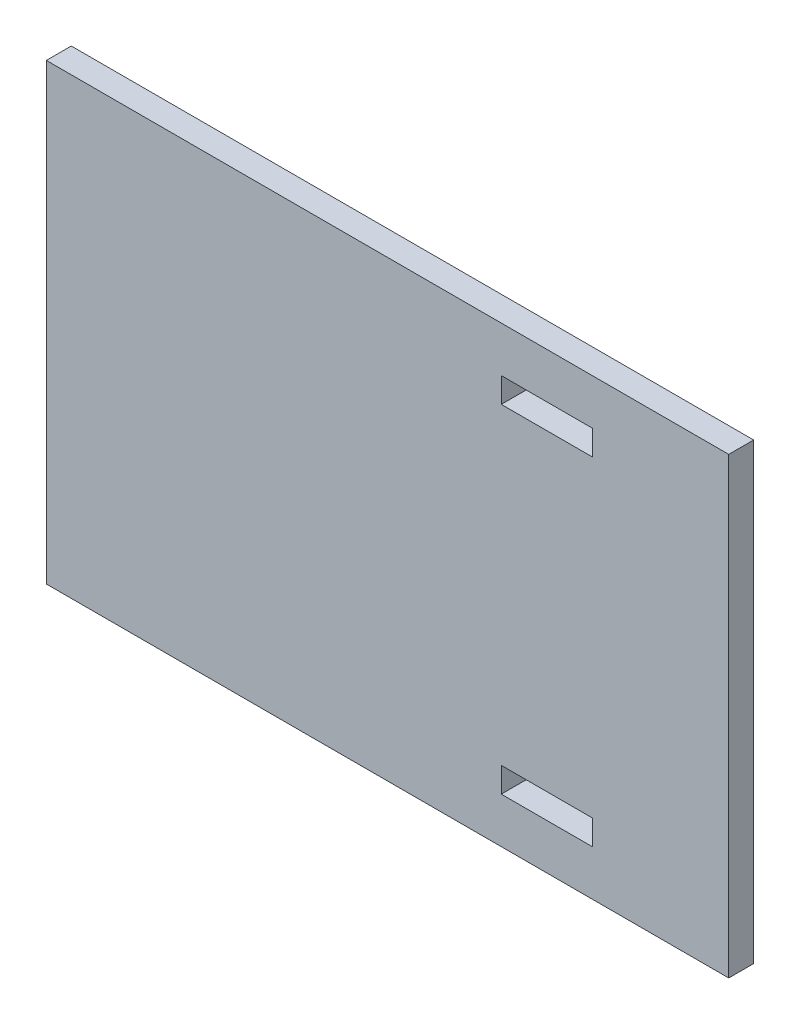
from build123d import *

# Parameters (mm, degrees)
SKETCH1_W           = 49.84
SKETCH1_H           = 75
SKETCH1_W_2         = 2.74
SKETCH1_H_2         = 10
BOSS_EXTRUDE1_DEPTH = 2.74


with BuildPart() as part:
    # Sketch1 → Boss-Extrude1 (new body)
    with BuildSketch(Plane(origin=(0, 0, 0), x_dir=(0, 1, 0), z_dir=(0, 0, 1))):
        with Locations((24.92, 37.5)):
            Rectangle(SKETCH1_W, SKETCH1_H)
        with Locations((43.47, 20)):
            Rectangle(SKETCH1_W_2, SKETCH1_H_2, mode=Mode.SUBTRACT)
        with Locations((6.37, 20)):
            Rectangle(SKETCH1_W_2, SKETCH1_H_2, mode=Mode.SUBTRACT)
    extrude(amount=BOSS_EXTRUDE1_DEPTH)


solid = part.part
